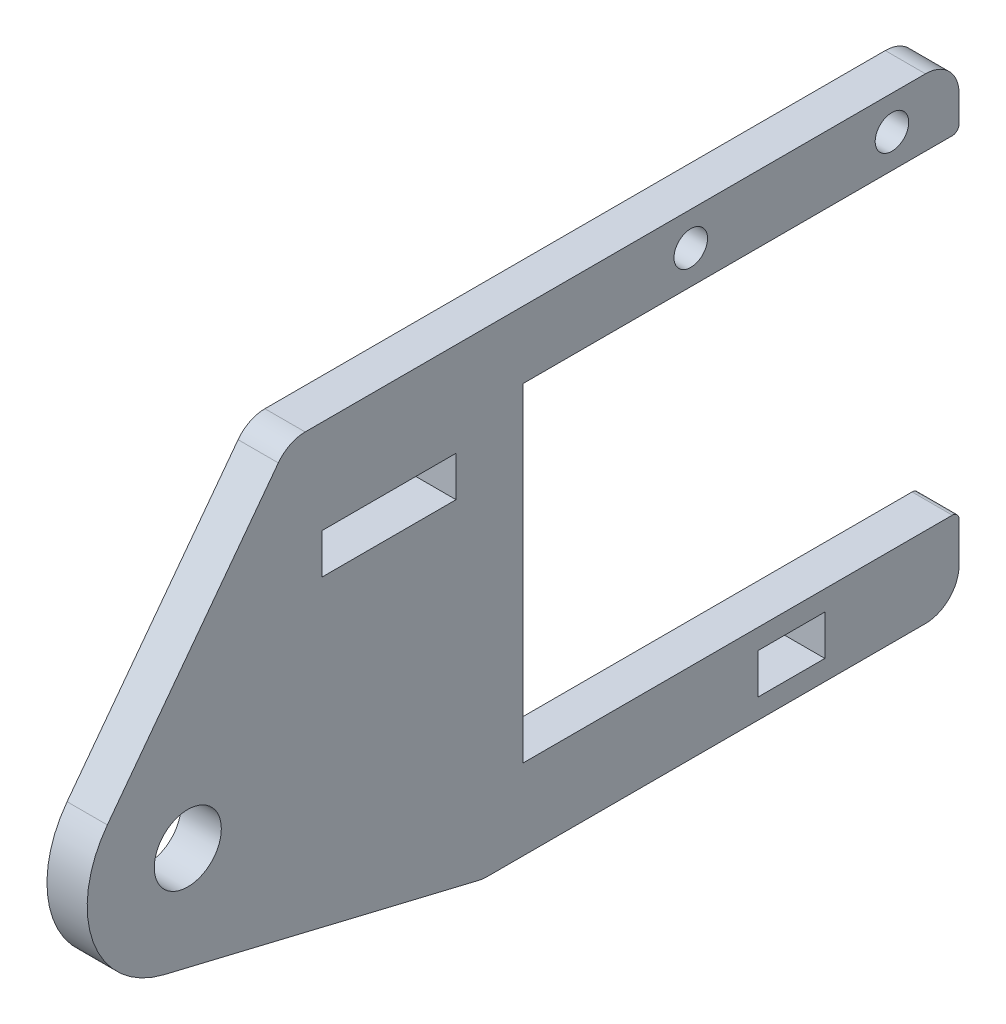
from build123d import *

# Parameters (mm, degrees)
SKETCH1_R           = 5
SKETCH1_R_2         = 2.5
SKETCH1_W           = 10
SKETCH1_H           = 6
SKETCH1_W_2         = 20
BOSS_EXTRUDE1_DEPTH = 6
FILLET1_R           = 5
FILLET2_R           = 1


with BuildPart() as part:
    # Sketch1 → Boss-Extrude1 (new body)
    with BuildSketch(Plane(origin=(0, 0, 0), x_dir=(0, 0, -1), z_dir=(1, 0, 0))):
        with BuildLine():
            Line((0, 5), (65, 5))
            Line((65, 5), (65, 15))
            Line((65, 15), (-35, 15))
            Line((-35, 15), (-62, -21))
            ThreePointArc((-62, -21), (-64.112397745, -35.083328622), (-53.504672381, -44.584830184))
            Line((-53.504672381, -44.584830184), (-6, -56))
            Line((-6, -56), (65, -56))
            Line((65, -56), (65, -44))
            Line((65, -44), (0, -44))
            Line((0, -44), (0, 5))
        make_face()
        with Locations((-50, -30)):
            Circle(SKETCH1_R, mode=Mode.SUBTRACT)
        with Locations((55, 10)):
            Circle(SKETCH1_R_2, mode=Mode.SUBTRACT)
        with Locations((25, 10)):
            Circle(SKETCH1_R_2, mode=Mode.SUBTRACT)
        with Locations((40, -50)):
            Rectangle(SKETCH1_W, SKETCH1_H, mode=Mode.SUBTRACT)
        with Locations((-20, -2)):
            Rectangle(SKETCH1_W_2, SKETCH1_H, mode=Mode.SUBTRACT)
    extrude(amount=BOSS_EXTRUDE1_DEPTH)

    # Fillet1
    fillet1_edges = [part.edges().sort_by_distance(p)[0] for p in [
        (3, -56, -65),
        (3, -56, 6),
        (3, 15, 35),
        (3, 15, -65),
    ]]
    fillet(fillet1_edges, radius=FILLET1_R)

    # Fillet2
    fillet2_edges = [part.edges().sort_by_distance(p)[0] for p in [
        (3, 5, -65),
        (3, -44, -65),
    ]]
    fillet(fillet2_edges, radius=FILLET2_R)


solid = part.part
